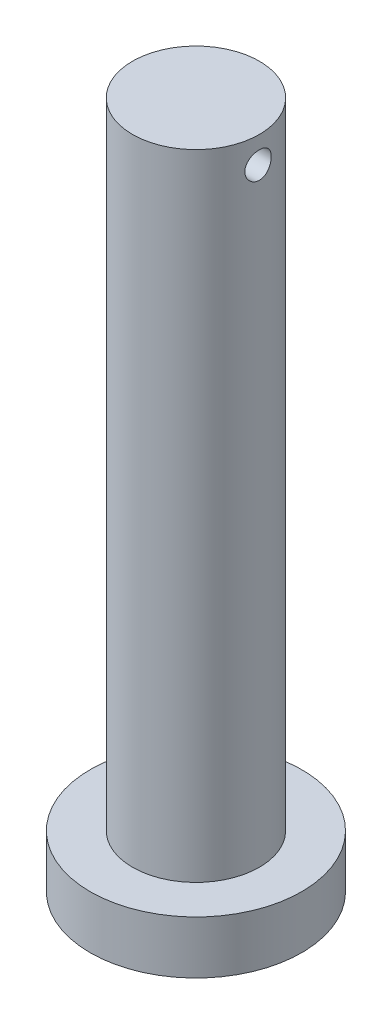
from build123d import *

# Parameters (mm, degrees)
SKETCH1_R               = 6
BOSS_EXTRUDE1_DEPTH     = 60
SKETCH1_3_R             = 10
BOSS_EXTRUDE2_DEPTH     = 5
CUT_EXTRUDE1_DEPTH      = 62.64414003
CUT_EXTRUDE1_DEPTH_BACK = 62.64414003
SKETCH2_R               = 1.25


with BuildPart() as part:
    # Sketch1 → Boss-Extrude1 (new body)
    with BuildSketch(Plane(origin=(0, 0, 0), x_dir=(1, 0, 0), z_dir=(0, 1, 0))):
        Circle(SKETCH1_R)
    extrude(amount=BOSS_EXTRUDE1_DEPTH)

    # Sketch1<3> → Boss-Extrude2 (add)
    with BuildSketch(Plane(origin=(0, 0, 0), x_dir=(1, 0, 0), z_dir=(0, 1, 0))):
        Circle(SKETCH1_3_R)
    extrude(amount=-BOSS_EXTRUDE2_DEPTH)

    # Sketch2 → Cut-Extrude1 (cut, two sides: drawn at the far end of the back side and taken through both)
    with BuildSketch(Plane(origin=(0, 0, 0), x_dir=(0, 0, -1), z_dir=(1, 0, 0)).offset(-CUT_EXTRUDE1_DEPTH_BACK)):
        with Locations((0, 57.5)):
            Circle(SKETCH2_R)
    extrude(amount=CUT_EXTRUDE1_DEPTH + CUT_EXTRUDE1_DEPTH_BACK, mode=Mode.SUBTRACT)


solid = part.part
